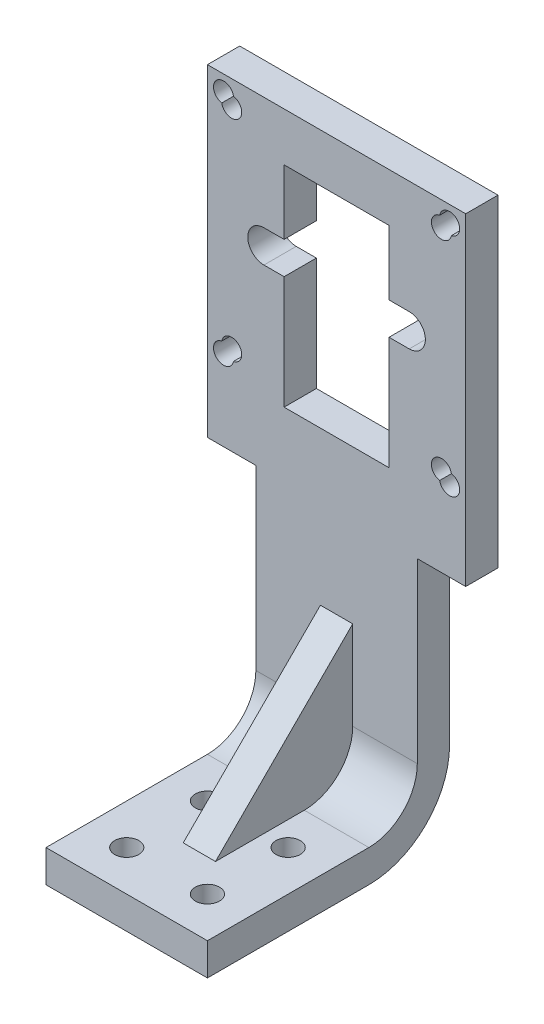
from build123d import *

# Parameters (mm, degrees)
EXTRUDE_1_DEPTH     = 4
EXTRUDE_3_DEPTH     = 20
RIB_1_REACH         = 70.964
SKETCH_5_WALL_W     = 163.463051102
SKETCH_5_WALL_H     = 4
SKETCH_6_R          = 1.5
CUT_EXTRUDE_3_DEPTH = 10


with BuildPart() as part:
    # 草图1 → 凸台-拉伸1 (new body)
    with BuildSketch(Plane.XY):
        Polygon((0, 20), (0, 0), (20, 0), (20, 20), (26, 20), (26, 60), (-6, 60), (-6, 20), align=None)
        with BuildLine():
            Line((3.5, 54), (3.5, 46))
            Line((3.5, 46), (1, 46))
            ThreePointArc((1, 46), (-1, 44), (1, 42))
            Line((1, 42), (3.5, 42))
            Line((3.5, 42), (3.5, 28))
            Line((3.5, 28), (16.5, 28))
            Line((16.5, 28), (16.5, 42))
            Line((16.5, 42), (19, 42))
            ThreePointArc((19, 42), (21, 44), (19, 46))
            Line((19, 46), (16.5, 46))
            Line((16.5, 46), (16.5, 54))
            Line((16.5, 54), (3.5, 54))
        make_face(mode=Mode.SUBTRACT)
        with BuildLine():
            ThreePointArc((24.228868987, 56.771131013), (24.883883476, 58.883883476), (22.771131013, 58.228868987))
            ThreePointArc((22.771131013, 58.228868987), (22.116116524, 56.116116524), (24.228868987, 56.771131013))
        make_face(mode=Mode.SUBTRACT)
        with BuildLine():
            ThreePointArc((24.228868987, 31.228868987), (22.116116524, 31.883883476), (22.771131013, 29.771131013))
            ThreePointArc((22.771131013, 29.771131013), (24.883883476, 29.116116524), (24.228868987, 31.228868987))
        make_face(mode=Mode.SUBTRACT)
        with BuildLine():
            ThreePointArc((-4.228868987, 31.228868987), (-4.883883476, 29.116116524), (-2.771131013, 29.771131013))
            ThreePointArc((-2.771131013, 29.771131013), (-2.116116524, 31.883883476), (-4.228868987, 31.228868987))
        make_face(mode=Mode.SUBTRACT)
        with BuildLine():
            ThreePointArc((-2.771131013, 58.228868987), (-4.883883476, 58.883883476), (-4.228868987, 56.771131013))
            ThreePointArc((-4.228868987, 56.771131013), (-2.116116524, 56.116116524), (-2.771131013, 58.228868987))
        make_face(mode=Mode.SUBTRACT)
    extrude(amount=EXTRUDE_1_DEPTH)

    # 草图4 → 凸台-拉伸3 (add)
    with BuildSketch(Plane.ZY):
        with BuildLine():
            Line((0, 0), (0, -2))
            ThreePointArc((0, -2), (2.928932188, -9.071067812), (10, -12))
            Line((10, -12), (30, -12))
            Line((30, -12), (30, -8))
            Line((30, -8), (10, -8))
            ThreePointArc((10, -8), (5.757359313, -6.242640687), (4, -2))
            Line((4, -2), (4, 0))
            Line((4, 0), (0, 0))
        make_face()
    extrude(amount=-EXTRUDE_3_DEPTH)

    # 草图5 wall → 筋1 (add, up to next)
    with BuildSketch(Plane(origin=(10, 0.678932188, 12.321067812), x_dir=(0, 0.707106781187, -0.707106781187), z_dir=(0, -0.707106781187, -0.707106781187)), mode=Mode.PRIVATE) as rib_1_sk1:
        Rectangle(SKETCH_5_WALL_W, SKETCH_5_WALL_H)
    rib_1_tool1 = extrude(rib_1_sk1.sketch, amount=RIB_1_REACH, mode=Mode.PRIVATE) - part.part
    add(rib_1_tool1.solids().sort_by_distance((10, 0.678932188, 12.321067812))[0])

    # 草图6 → 切除-拉伸3 (cut)
    with BuildSketch(Plane.XZ.offset(12)):
        with Locations((5, 25)):
            Circle(SKETCH_6_R)
        with Locations((5, 15)):
            Circle(SKETCH_6_R)
        with Locations(Location((15, 15, 0), (0, 0, 90))):
            Circle(SKETCH_6_R)
        with Locations(Location((15, 25, 0), (0, 0, 90))):
            Circle(SKETCH_6_R)
    extrude(amount=-CUT_EXTRUDE_3_DEPTH, mode=Mode.SUBTRACT)


solid = part.part
